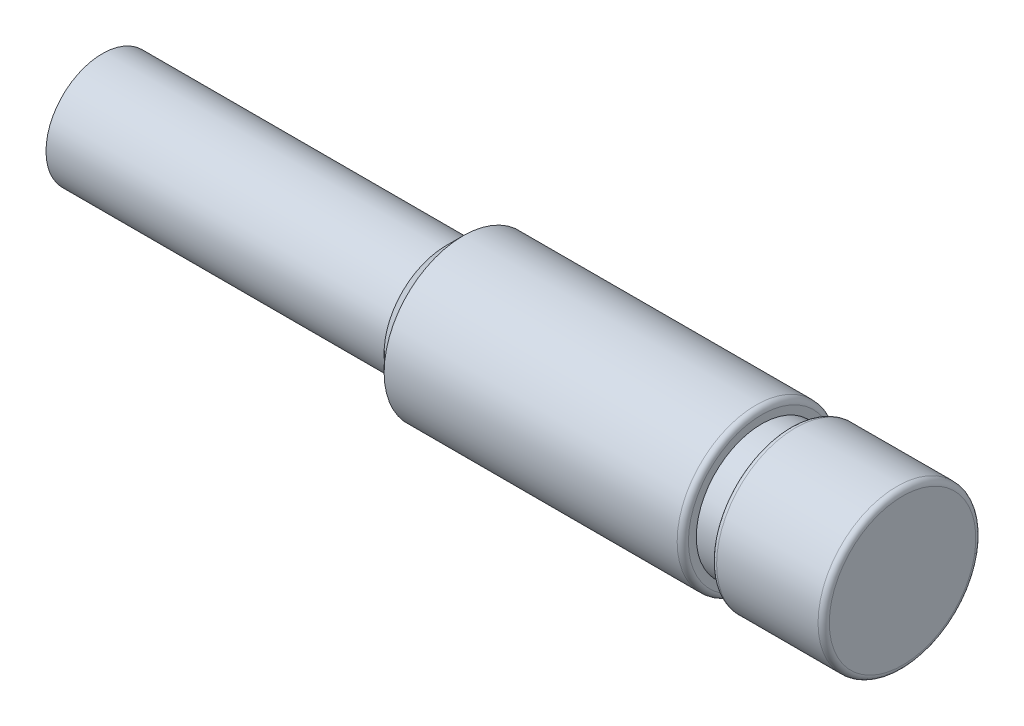
from build123d import *

# Parameters (mm, degrees)
ESBO_O2_R             = 3
CORTE_EXTRUS_O1_DEPTH = 3.6
CHANFRO2_SIZE         = 1.5
CHANFRO2_SIZE2        = 3.216760381
CHANFRO3_SIZE         = 1.5
FILETE3_R             = 0.5


with BuildPart() as part:
    # Esboço1 → Revolução1 (revolve)
    with BuildSketch(Plane.XY, mode=Mode.PRIVATE) as revolu_o1_sk:
        Polygon((0, 0), (71, 0), (71, 7), (61, 7), (61, 5.8), (58.5, 5.8), (58.5, 7), (30.5, 7), (30.5, 5), (0, 5), align=None)
    revolve(revolu_o1_sk.sketch.rotate(Axis((0, 0, 0), (1, 0, 0)), 90), axis=Axis((0, 0, 0), (1, 0, 0)))

    # Esboço2 → Corte-extrusão1 (cut)
    with BuildSketch(Plane.ZY):
        Circle(ESBO_O2_R)
    extrude(amount=-CORTE_EXTRUS_O1_DEPTH, mode=Mode.SUBTRACT)

    # Chanfro2
    chanfro2_edges = [part.edges().sort_by_distance(p)[0] for p in [
        (0, 0, -3),
    ]]
    chanfro2_side = [part.faces().sort_by_distance(p)[0] for p in [
        (0, 0, -4.858578644),
    ]]
    chamfer(chanfro2_edges, length=CHANFRO2_SIZE, length2=CHANFRO2_SIZE2, reference=chanfro2_side[0])

    # Chanfro3
    chanfro3_edges = [part.edges().sort_by_distance(p)[0] for p in [
        (30.5, 0, -7),
    ]]
    chamfer(chanfro3_edges, length=CHANFRO3_SIZE)

    # Filete3
    filete3_edges = [part.edges().sort_by_distance(p)[0] for p in [
        (71, 0, -7),
        (58.5, 0, -7),
        (61, 0, -7),
    ]]
    fillet(filete3_edges, radius=FILETE3_R)


solid = part.part
